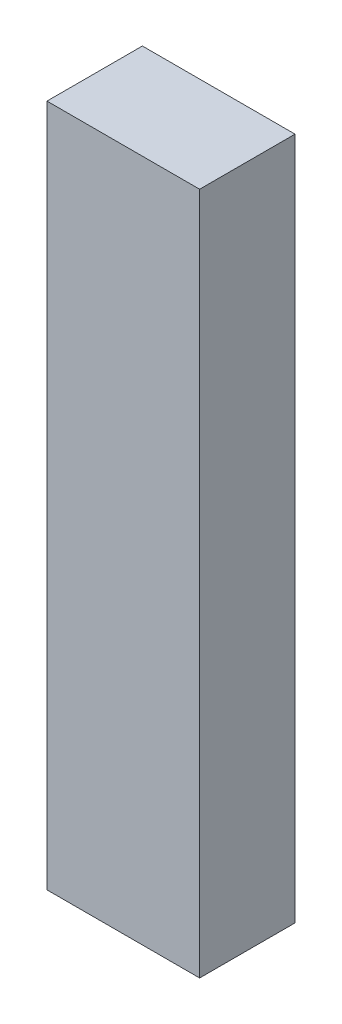
from build123d import *

# Parameters (mm, degrees)
DET2_KABLO_KANALI_40X25_1_START = -775
SKETCH1_W                       = 40
SKETCH1_H                       = 179
DET2_KABLO_KANALI_40X25_1_DEPTH = 25


with BuildPart() as part:
    # Sketch1 → DET2_kablo_kanali_40x25_1 (new body)
    with BuildSketch(Plane.XY.offset(DET2_KABLO_KANALI_40X25_1_START)):
        with Locations((1318, 1558.5)):
            Rectangle(SKETCH1_W, SKETCH1_H)
    extrude(amount=-DET2_KABLO_KANALI_40X25_1_DEPTH)


solid = part.part
